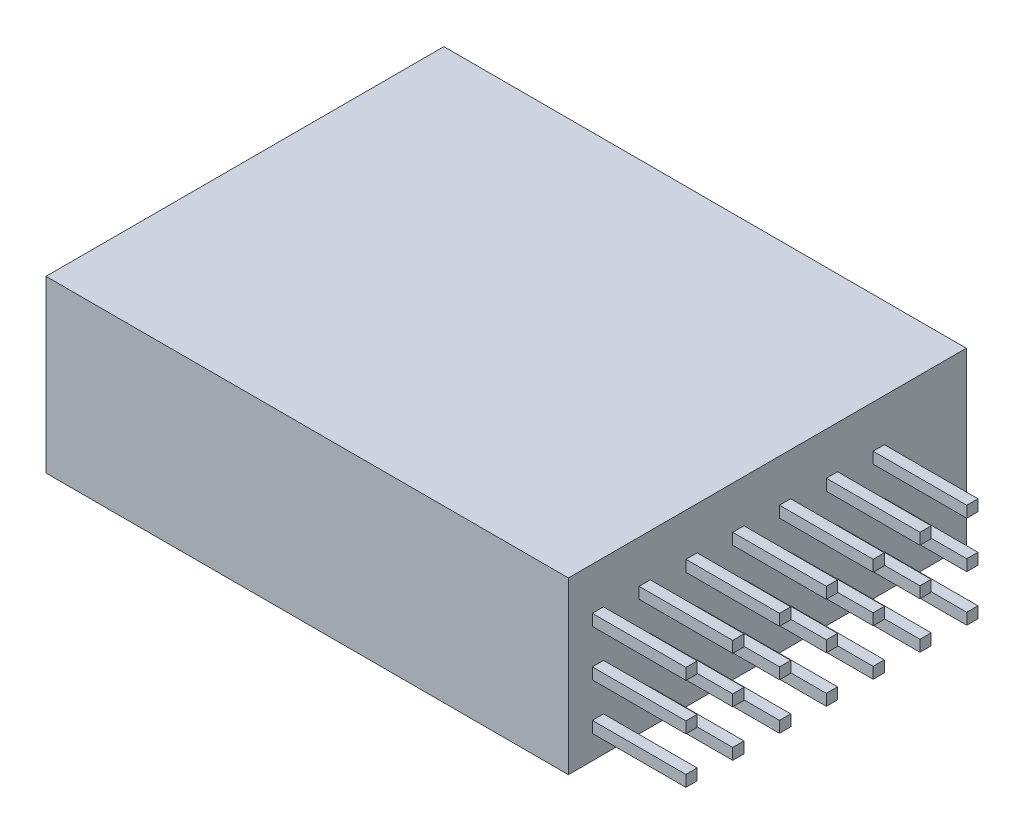
from build123d import *

# Parameters (mm, degrees)
SKETCH1_W           = 28.3464
SKETCH1_H           = 21.59
BOSS_EXTRUDE1_DEPTH = 9.2456
SKETCH2_W           = 0.6096
SKETCH2_H           = 0.6096
BOSS_EXTRUDE2_DEPTH = 5.08
LPATTERN1_COUNT     = 7
LPATTERN1_PITCH     = 2.54


with BuildPart() as part:
    # Sketch1 → Boss-Extrude1 (new body)
    with BuildSketch(Plane(origin=(0, 0, 0), x_dir=(1, 0, 0), z_dir=(0, 1, 0))):
        with Locations((14.1732, 10.795)):
            Rectangle(SKETCH1_W, SKETCH1_H)
    extrude(amount=BOSS_EXTRUDE1_DEPTH)

    # Sketch2 → Boss-Extrude2 (add)
    with BuildSketch(Plane(origin=(28.3464, 0, 0), x_dir=(0, 0, -1), z_dir=(1, 0, 0))):
        with Locations((1.6002, 6.6294)):
            Rectangle(SKETCH2_W, SKETCH2_H)
        with Locations((1.6002, 1.6002)):
            Rectangle(SKETCH2_W, SKETCH2_H)
        with Locations((1.6002, 4.1148)):
            Rectangle(SKETCH2_W, SKETCH2_H)
    boss_extrude2 = extrude(amount=BOSS_EXTRUDE2_DEPTH)

    # LPattern1: Boss-Extrude2 ×7
    with Locations(*[(0, 0, -i * LPATTERN1_PITCH) for i in range(1, LPATTERN1_COUNT)]):
        add(boss_extrude2)


solid = part.part
